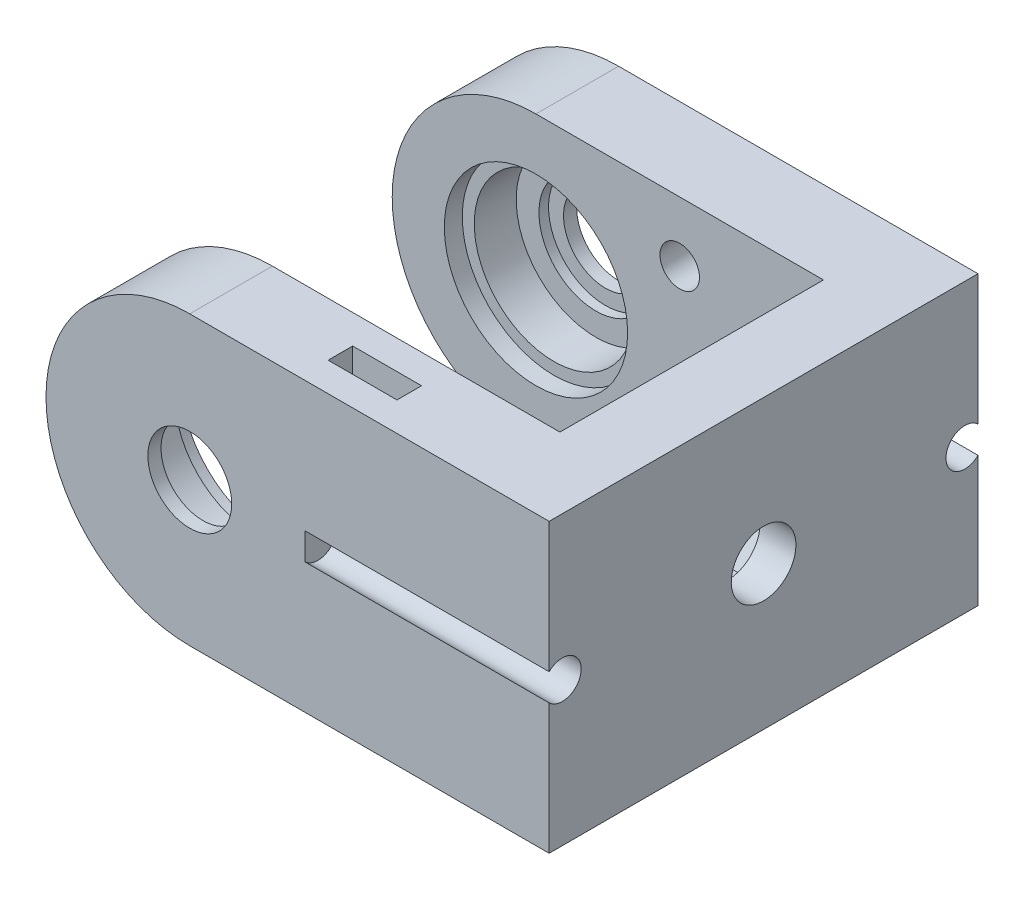
from build123d import *

# Parameters (mm, degrees)
BOSS_EXTRUDE1_DEPTH      = 17.9
BOSS_EXTRUDE1_DEPTH_BACK = 17.9
CUT_EXTRUDE1_DEPTH       = 48.206037749
CUT_EXTRUDE1_DEPTH_BACK  = 48.206037749
SKETCH3_W                = 36
SKETCH3_H                = 22
CUT_EXTRUDE2_DEPTH       = 12.5
CUT_EXTRUDE2_DEPTH_BACK  = 12.5
SKETCH4_R                = 7.65
CUT_EXTRUDE3_DEPTH       = 16
CUT_EXTRUDE3_DEPTH_BACK  = 16
SKETCH5_R                = 6.65
CUT_EXTRUDE4_DEPTH       = 16.8
CUT_EXTRUDE4_DEPTH_BACK  = 16.8
SKETCH6_R                = 4.75
CUT_EXTRUDE5_DEPTH       = 48.206037749
CUT_EXTRUDE5_DEPTH_BACK  = 48.206037749
SKETCH7_R                = 3.5
CUT_EXTRUDE6_DEPTH       = 48.206037749
CUT_EXTRUDE6_DEPTH_BACK  = 20.4
CUT_EXTRUDE7_DEPTH       = 48.206037749
CUT_EXTRUDE7_DEPTH_BACK  = 48.206037749
SKETCH11_R               = 2.7
CUT_EXTRUDE8_DEPTH       = 3
SKETCH14_R               = 1.65
CUT_EXTRUDE10_DEPTH      = 33.3
SKETCH15_R               = 2.7
CUT_EXTRUDE11_DEPTH      = 3.3
SKETCH16_W               = 5.75
SKETCH16_H               = 2.05
CUT_EXTRUDE12_DEPTH      = 7.665


with BuildPart() as part:
    # Sketch2 → Boss-Extrude1 (new, two sides: drawn at the far end of the back side and taken through both)
    with BuildSketch(Plane.XY.offset(-BOSS_EXTRUDE1_DEPTH_BACK)):
        with BuildLine():
            Line((-30, -12), (0, -12))
            Line((0, -12), (0, 12))
            Line((0, 12), (-30, 12))
            ThreePointArc((-30, 12), (-42, 0), (-30, -12))
        make_face()
    extrude(amount=BOSS_EXTRUDE1_DEPTH + BOSS_EXTRUDE1_DEPTH_BACK)

    # Sketch3 → Cut-Extrude1 (cut, two sides: drawn at the far end of the back side and taken through both)
    with BuildSketch(Plane(origin=(0, 0, 0), x_dir=(1, 0, 0), z_dir=(0, 1, 0)).offset(-CUT_EXTRUDE1_DEPTH_BACK)):
        with Locations((-24, 0)):
            Rectangle(SKETCH3_W, SKETCH3_H)
    extrude(amount=CUT_EXTRUDE1_DEPTH + CUT_EXTRUDE1_DEPTH_BACK, mode=Mode.SUBTRACT)

    # Sketch4 → Cut-Extrude2 (cut, two sides: drawn at the far end of the back side and taken through both)
    with BuildSketch(Plane.XY.offset(-CUT_EXTRUDE2_DEPTH_BACK)):
        with Locations((-30, 0)):
            Circle(SKETCH4_R)
    extrude(amount=CUT_EXTRUDE2_DEPTH + CUT_EXTRUDE2_DEPTH_BACK, mode=Mode.SUBTRACT)

    # Sketch5 → Cut-Extrude3 (cut, two sides: drawn at the far end of the back side and taken through both)
    with BuildSketch(Plane.XY.offset(-CUT_EXTRUDE3_DEPTH_BACK)):
        with Locations((-30, 0)):
            Circle(SKETCH5_R)
    extrude(amount=CUT_EXTRUDE3_DEPTH + CUT_EXTRUDE3_DEPTH_BACK, mode=Mode.SUBTRACT)

    # Sketch6 → Cut-Extrude4 (cut, two sides: drawn at the far end of the back side and taken through both)
    with BuildSketch(Plane.XY.offset(-CUT_EXTRUDE4_DEPTH_BACK)):
        with Locations((-30, 0)):
            Circle(SKETCH6_R)
    extrude(amount=CUT_EXTRUDE4_DEPTH + CUT_EXTRUDE4_DEPTH_BACK, mode=Mode.SUBTRACT)

    # Sketch7 → Cut-Extrude5 (cut, two sides: drawn at the far end of the back side and taken through both)
    with BuildSketch(Plane.XY.offset(-CUT_EXTRUDE5_DEPTH_BACK)):
        with Locations((-30, 0)):
            Circle(SKETCH7_R)
    extrude(amount=CUT_EXTRUDE5_DEPTH + CUT_EXTRUDE5_DEPTH_BACK, mode=Mode.SUBTRACT)

    # Sketch10 → Cut-Extrude6 (cut, two sides: drawn at the far end of the back side and taken through both)
    with BuildSketch(Plane(origin=(0, 0, 0), x_dir=(0, 0, -1), z_dir=(1, 0, 0)).offset(-CUT_EXTRUDE6_DEPTH_BACK)):
        with BuildLine():
            Line((-17.9, 1.127220032), (-17.9, -1.127220032))
            ThreePointArc((-17.9, -1.127220032), (-15.225, 0), (-17.9, 1.127220032))
        make_face()
        with BuildLine():
            Line((17.9, 1.127220032), (17.9, -1.127220032))
            ThreePointArc((17.9, -1.127220032), (15.225, 0), (17.9, 1.127220032))
        make_face()
    extrude(amount=CUT_EXTRUDE6_DEPTH + CUT_EXTRUDE6_DEPTH_BACK, mode=Mode.SUBTRACT)

    # Sketch11 → Cut-Extrude7 (cut, two sides: drawn at the far end of the back side and taken through both)
    with BuildSketch(Plane(origin=(0, 0, 0), x_dir=(0, 0, -1), z_dir=(1, 0, 0)).offset(-CUT_EXTRUDE7_DEPTH_BACK)):
        Circle(SKETCH11_R)
    extrude(amount=CUT_EXTRUDE7_DEPTH + CUT_EXTRUDE7_DEPTH_BACK, mode=Mode.SUBTRACT)

    # Sketch12 → Cut-Extrude8 (cut)
    with BuildSketch(Plane.ZY.offset(6)):
        Polygon((-4.705404694, 0), (-2.352702347, -4.075), (2.352702347, -4.075), (4.705404694, 0), (2.352702347, 4.075), (-2.352702347, 4.075), align=None)
    extrude(amount=-CUT_EXTRUDE8_DEPTH, mode=Mode.SUBTRACT)

    # Sketch14 → Cut-Extrude10 (cut)
    with BuildSketch(Plane(origin=(0, 0, -17.9), x_dir=(-1, 0, 0), z_dir=(0, 0, -1))):
        with Locations((18, -7)):
            Circle(SKETCH14_R)
    cut_extrude10 = extrude(amount=-CUT_EXTRUDE10_DEPTH, mode=Mode.SUBTRACT)

    # Sketch15 → Cut-Extrude11 (cut)
    with BuildSketch(Plane(origin=(0, 0, -17.9), x_dir=(-1, 0, 0), z_dir=(0, 0, -1))):
        with Locations((18, -7)):
            Circle(SKETCH15_R)
    cut_extrude11 = extrude(amount=-CUT_EXTRUDE11_DEPTH, mode=Mode.SUBTRACT)

    # Sketch16 → Cut-Extrude12 (cut)
    with BuildSketch(Plane.XZ.offset(12)):
        with Locations((-18, 14.45)):
            Rectangle(SKETCH16_W, SKETCH16_H)
    cut_extrude12 = extrude(amount=-CUT_EXTRUDE12_DEPTH, mode=Mode.SUBTRACT)

    # Mirror1: Cut-Extrude10, Cut-Extrude11, Cut-Extrude12 across plane
    add(cut_extrude10.mirror(Plane.ZX), mode=Mode.SUBTRACT)
    add(cut_extrude11.mirror(Plane.ZX), mode=Mode.SUBTRACT)
    add(cut_extrude12.mirror(Plane.ZX), mode=Mode.SUBTRACT)


solid = part.part
